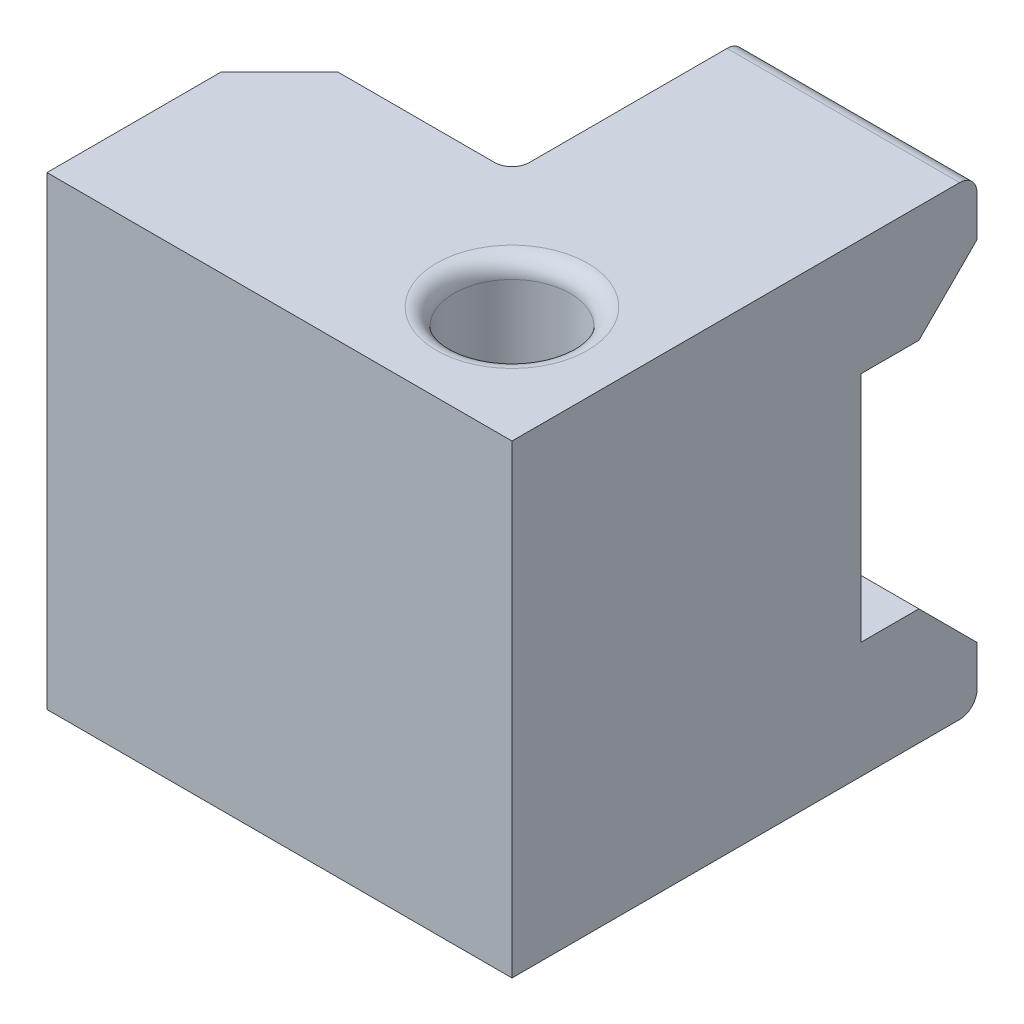
from build123d import *

# Parameters (mm, degrees)
SKETCH2_R           = 10
BOSS_EXTRUDE1_DEPTH = 80
SKETCH4_W           = 20
SKETCH4_H           = 40
CUT_EXTRUDE1_DEPTH  = 139.564064606
FILLET1_R           = 3
FILLET2_R           = 3
CHAMFER1_SIZE       = 10
CHAMFER2_SIZE       = 10
CHAMFER3_SIZE       = 10
FILLET4_R           = 3
FILLET5_R           = 3
FILLET6_R           = 3


with BuildPart() as part:
    # Sketch2 → Boss-Extrude1 (new body)
    with BuildSketch(Plane(origin=(0, 0, 0), x_dir=(1, 0, 0), z_dir=(0, 1, 0))):
        Polygon((0, 0), (-80, 0), (-80, 40), (-40, 40), (-40, 80), (0, 80), align=None)
        with Locations(Location((-20, 20, 0), (0, 0, 270))):
            Circle(SKETCH2_R, mode=Mode.SUBTRACT)
    extrude(amount=BOSS_EXTRUDE1_DEPTH)

    # Sketch4 → Cut-Extrude1 (cut, through all)
    with BuildSketch(Plane(origin=(0, 0, 0), x_dir=(0, 0, -1), z_dir=(1, 0, 0))):
        with Locations((70, 40)):
            Rectangle(SKETCH4_W, SKETCH4_H)
    extrude(amount=-CUT_EXTRUDE1_DEPTH, mode=Mode.SUBTRACT)

    # Fillet1
    fillet1_edges = [part.edges().sort_by_distance(p)[0] for p in [
        (-20, 0, -80),
    ]]
    fillet(fillet1_edges, radius=FILLET1_R)

    # Fillet2
    fillet2_edges = [part.edges().sort_by_distance(p)[0] for p in [
        (-20, 80, -80),
    ]]
    fillet(fillet2_edges, radius=FILLET2_R)

    # Chamfer1
    chamfer1_edges = [part.edges().sort_by_distance(p)[0] for p in [
        (-20, 60, -80),
    ]]
    chamfer(chamfer1_edges, length=CHAMFER1_SIZE)

    # Chamfer2
    chamfer2_edges = [part.edges().sort_by_distance(p)[0] for p in [
        (-20, 20, -80),
    ]]
    chamfer(chamfer2_edges, length=CHAMFER2_SIZE)

    # Chamfer3
    chamfer3_edges = [part.edges().sort_by_distance(p)[0] for p in [
        (-80, 40, -40),
    ]]
    chamfer(chamfer3_edges, length=CHAMFER3_SIZE)

    # Fillet4
    fillet4_edges = [part.edges().sort_by_distance(p)[0] for p in [
        (-40, 40, -40),
    ]]
    fillet(fillet4_edges, radius=FILLET4_R)

    # Fillet5
    fillet5_edges = [part.edges().sort_by_distance(p)[0] for p in [
        (-20, 0, -30),
    ]]
    fillet(fillet5_edges, radius=FILLET5_R)

    # Fillet6
    fillet6_edges = [part.edges().sort_by_distance(p)[0] for p in [
        (-20, 80, -30),
    ]]
    fillet(fillet6_edges, radius=FILLET6_R)


solid = part.part
